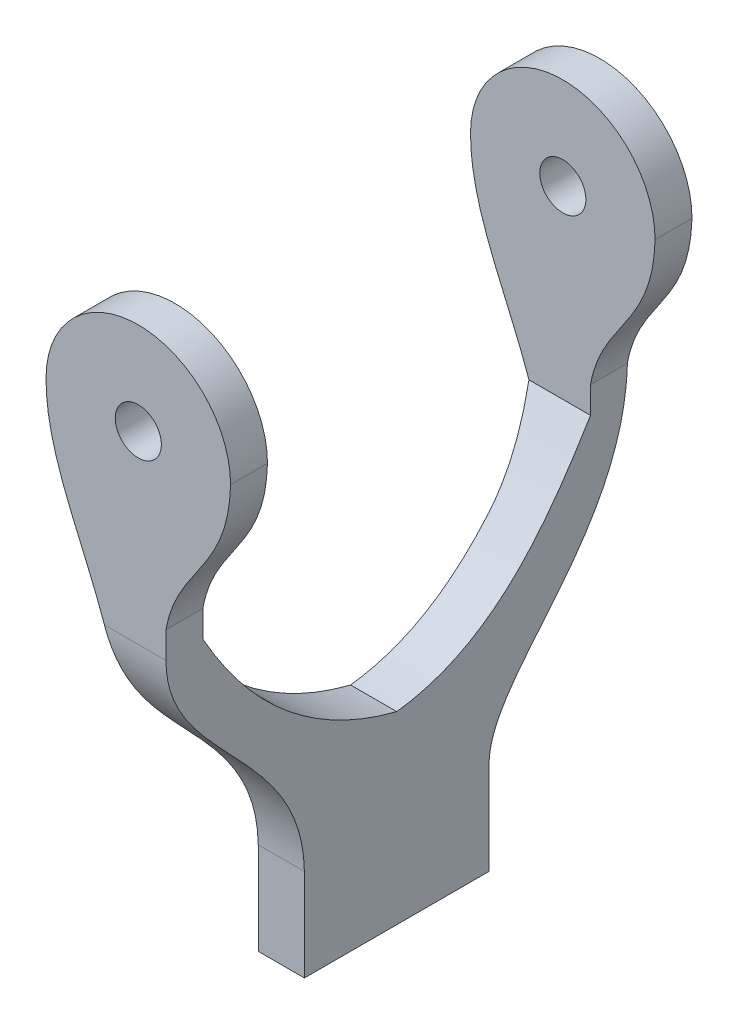
from build123d import *

# Parameters (mm, degrees)
ESQUISSE1_R                  = 2.5
BOSS_EXTRU_1_DEPTH           = 50
ENL_V_MAT_EXTRU_1_DEPTH      = 78.151108828
ENL_V_MAT_EXTRU_1_DEPTH_BACK = 78.151108828


with BuildPart() as part:
    # Esquisse1 → Boss.-Extru.1 (new body)
    with BuildSketch(Plane.XY):
        with BuildLine():
            ThreePointArc((10, 0), (0, 10), (-10, 0))
            add(Edge.make_bspline(
                [(-10, 0), (-10.038102543, -9.915248827), (-2.132148039, -18.010708935), (-2, -28.65)],
                knots=[0, 0, 0, 0, 1, 1, 1, 1], degree=3))
            Line((-2, -28.65), (-2, -57.3))
            Line((-2, -57.3), (3, -57.3))
            Line((3, -57.3), (3, -17.125696421))
            add(Edge.make_bspline(
                [(3, -17.125696421), (4.197007016, -10.30980911), (9.760537062, -8.681364111), (10, 0)],
                knots=[0.044553807, 0.044553807, 0.044553807, 0.044553807, 1.044553807, 1.044553807, 1.044553807, 1.044553807], degree=3))
        make_face()
        Circle(ESQUISSE1_R, mode=Mode.SUBTRACT)
    extrude(amount=BOSS_EXTRU_1_DEPTH)

    # Esquisse2 → Enlèv. mat.-Extru.1 (cut, two sides: drawn at the far end of the back side and taken through both)
    with BuildSketch(Plane(origin=(3, 0, 0), x_dir=(0, 0, -1), z_dir=(1, 0, 0)).offset(-ENL_V_MAT_EXTRU_1_DEPTH_BACK)):
        with BuildLine():
            Line((-50, -57.3), (-35, -57.3))
            Line((-35, -57.3), (-35, -47.3))
            add(Edge.make_bspline(
                [(-35, -47.3), (-35.232743916, -34.619508974), (-49.987287139, -30.383151659), (-50, -20)],
                knots=[0, 0, 0, 0, 1, 1, 1, 1], degree=3))
            Line((-50, -20), (-50, -57.3))
        make_face()
        with BuildLine():
            Line((-15, -47.3), (-15, -57.3))
            Line((-15, -57.3), (0, -57.3))
            Line((0, -57.3), (0, -17.125696421))
            add(Edge.make_bspline(
                [(0, -17.125696421), (-0.432832627, -32.702069391), (-14.978771971, -39.151873856), (-15, -47.3)],
                knots=[0.670508014, 0.670508014, 0.670508014, 0.670508014, 1.670508014, 1.670508014, 1.670508014, 1.670508014], degree=3))
        make_face()
        with BuildLine():
            add(Edge.make_bspline(
                [(-46, -20), (-40.775649876, -29.315136052), (-33.796978395, -35.093732661), (-25, -37.3)],
                knots=[0, 0, 0, 0, 1, 1, 1, 1], degree=3))
            add(Edge.make_bspline(
                [(-4, -20), (-8.708547212, -27.751388753), (-14.537623568, -36.046397597), (-25, -37.3)],
                knots=[0, 0, 0, 0, 1, 1, 1, 1], degree=3))
            Line((-4, -20), (-4, 10))
            Line((-4, 10), (-46, 10))
            Line((-46, 10), (-46, -20))
        make_face()
    extrude(amount=ENL_V_MAT_EXTRU_1_DEPTH + ENL_V_MAT_EXTRU_1_DEPTH_BACK, mode=Mode.SUBTRACT)


solid = part.part
